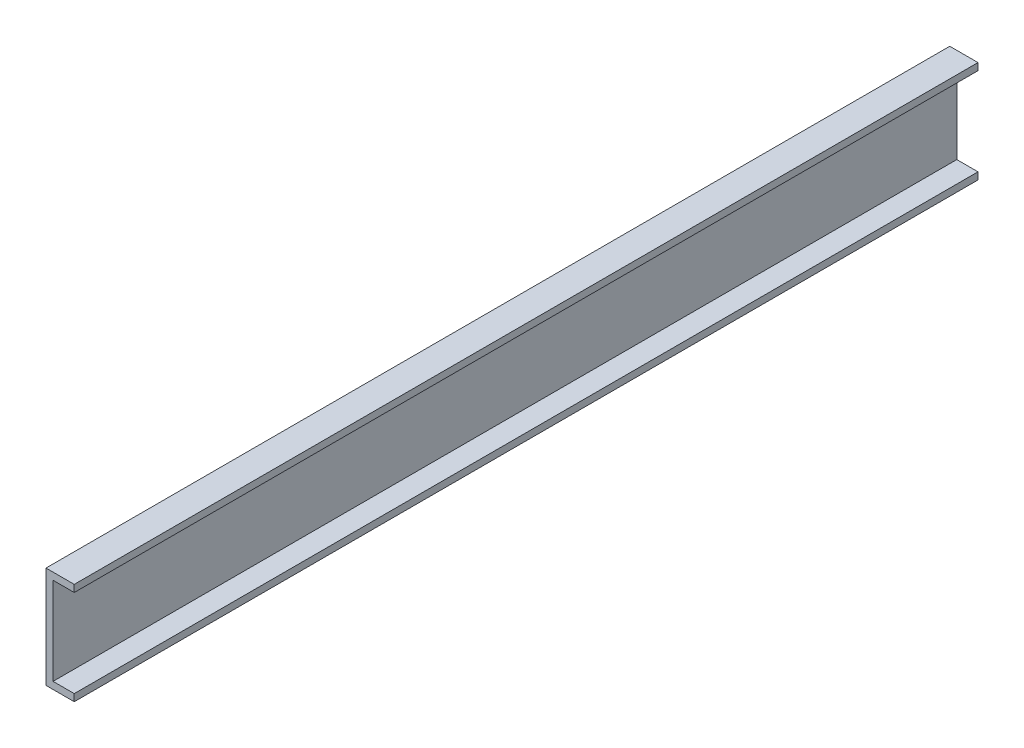
from build123d import *

# Parameters (mm, degrees)
SKETCH1_W           = 406.4
SKETCH1_H           = 45.72
BOSS_EXTRUDE1_DEPTH = 12.7
SKETCH2_W           = 9.525
SKETCH2_H           = 39.37
CUT_EXTRUDE1_DEPTH  = 410.160809951


with BuildPart() as part:
    # Sketch1 → Boss-Extrude1 (new body)
    with BuildSketch(Plane(origin=(0, 0, 0), x_dir=(0, 0, -1), z_dir=(1, 0, 0))):
        with Locations((203.2, 22.86)):
            Rectangle(SKETCH1_W, SKETCH1_H)
    extrude(amount=BOSS_EXTRUDE1_DEPTH)

    # Sketch2 → Cut-Extrude1 (cut, through all)
    with BuildSketch(Plane.XY):
        with Locations((7.9375, 22.86)):
            Rectangle(SKETCH2_W, SKETCH2_H)
    extrude(amount=-CUT_EXTRUDE1_DEPTH, mode=Mode.SUBTRACT)


solid = part.part
